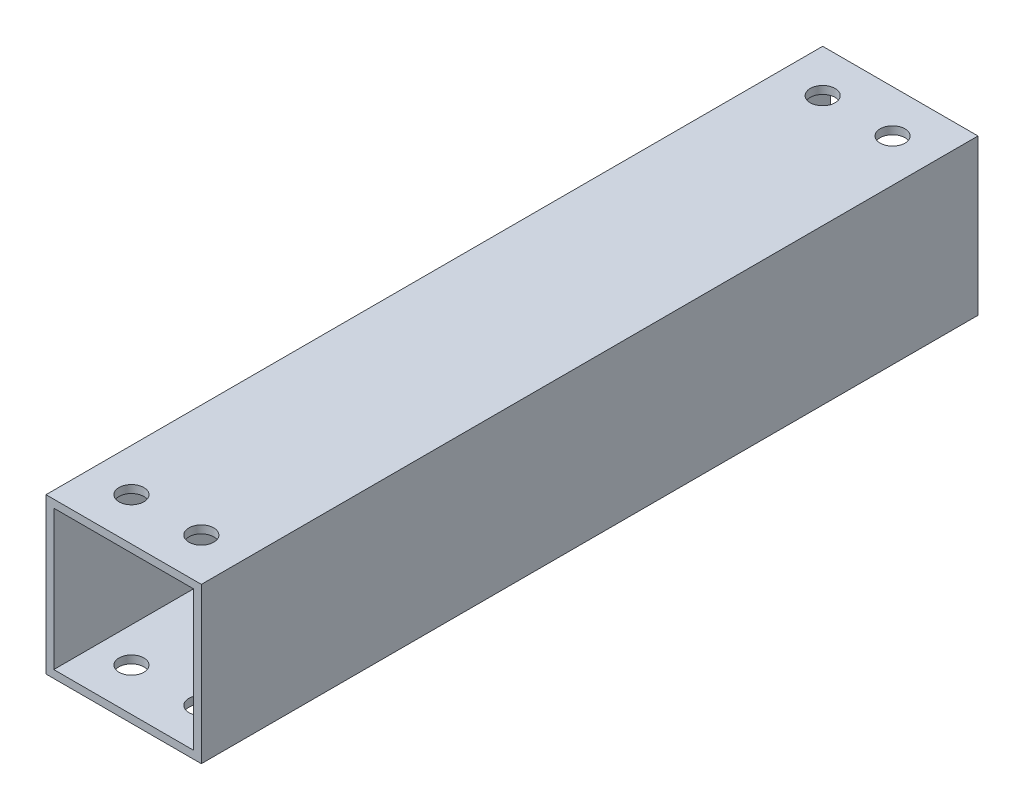
from build123d import *

# Parameters (mm, degrees)
SKETCH_1_W          = 20
SKETCH_1_H          = 20
SKETCH_1_W_2        = 18
SKETCH_1_H_2        = 18
EXTRUDE_1_DEPTH     = 100
SKETCH_2_R          = 1.6
CUT_EXTRUDE_1_DEPTH = 103.46950766


with BuildPart() as part:
    # 草图1 → 凸台-拉伸1 (new body)
    with BuildSketch(Plane.XY):
        Rectangle(SKETCH_1_W, SKETCH_1_H)
        Rectangle(SKETCH_1_W_2, SKETCH_1_H_2, mode=Mode.SUBTRACT)
    extrude(amount=EXTRUDE_1_DEPTH)

    # 草图2 → 切除-拉伸1 (cut, through all)
    with BuildSketch(Plane(origin=(0, 10, 0), x_dir=(1, 0, 0), z_dir=(0, 1, 0))):
        with Locations(Location((4.5, -94.5, 0), (0, 0, 270))):
            Circle(SKETCH_2_R)
        with Locations(Location((-4.5, -94.5, 0), (0, 0, 270))):
            Circle(SKETCH_2_R)
        with Locations(Location((-4.5, -5.5, 0), (0, 0, 270))):
            Circle(SKETCH_2_R)
        with Locations(Location((4.5, -5.5, 0), (0, 0, 270))):
            Circle(SKETCH_2_R)
    extrude(amount=-CUT_EXTRUDE_1_DEPTH, mode=Mode.SUBTRACT)


solid = part.part
